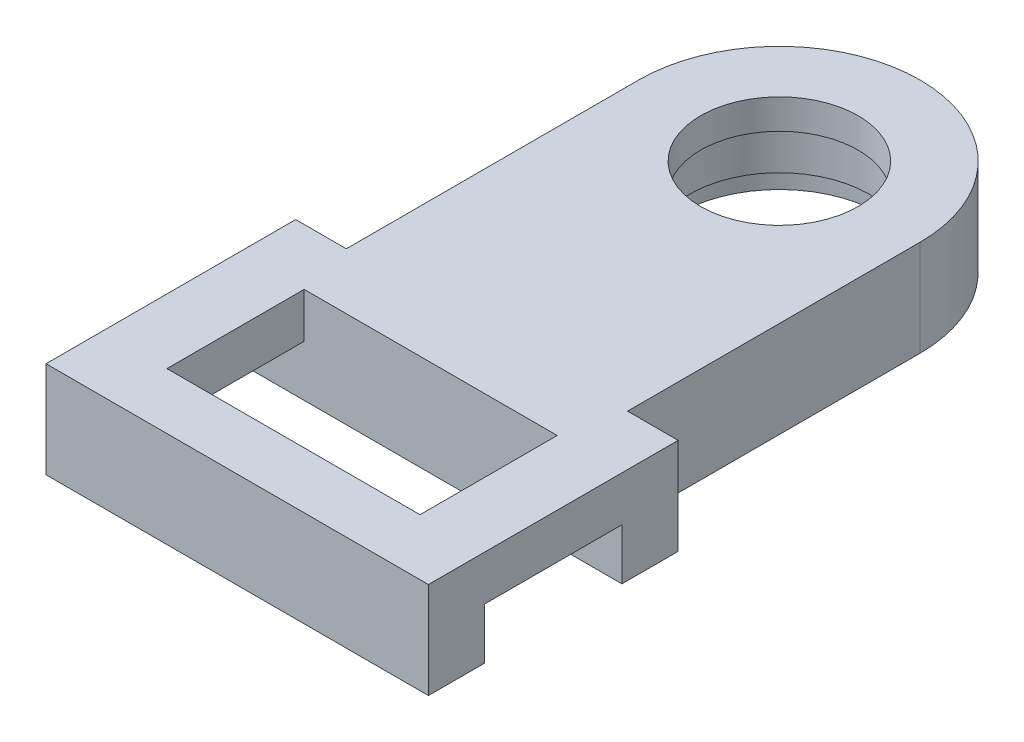
from build123d import *

# Parameters (mm, degrees)
SKETCH1_W           = 34
SKETCH1_H           = 22.2
SKETCH1_W_2         = 22.5
SKETCH1_H_2         = 12.2
BOSS_EXTRUDE1_DEPTH = 4
SKETCH2_R           = 8
BOSS_EXTRUDE3_DEPTH = 4
SKETCH3_R           = 9
SKETCH3_R_2         = 8
BOSS_EXTRUDE4_DEPTH = 2.55
SKETCH4_R           = 9
BOSS_EXTRUDE5_DEPTH = 4.55
SKETCH5_R           = 8
SKETCH5_R_2         = 7
BOSS_EXTRUDE8_DEPTH = 2.65


with BuildPart() as part:
    # Sketch1 → Boss-Extrude1 (new body)
    with BuildSketch(Plane(origin=(0, 0, 0), x_dir=(1, 0, 0), z_dir=(0, 1, 0))):
        Rectangle(SKETCH1_W, SKETCH1_H)
        Rectangle(SKETCH1_W_2, SKETCH1_H_2, mode=Mode.SUBTRACT)
    extrude(amount=BOSS_EXTRUDE1_DEPTH)

    # Sketch2 → Boss-Extrude3 (add, through all)
    with BuildSketch(Plane(origin=(0, 4, 0), x_dir=(1, 0, 0), z_dir=(0, 1, 0))):
        with BuildLine():
            Line((-12.5, 37.1), (-12.5, 11.1))
            Line((-12.5, 11.1), (12.5, 11.1))
            Line((12.5, 11.1), (12.5, 37.1))
            ThreePointArc((12.5, 37.1), (0, 49.6), (-12.5, 37.1))
        make_face()
        with Locations(Location((0, 37.1, 0), (0, 0, 270))):
            Circle(SKETCH2_R, mode=Mode.SUBTRACT)
    extrude(amount=-BOSS_EXTRUDE3_DEPTH)

    # Sketch3 → Boss-Extrude4 (add)
    with BuildSketch(Plane.XZ):
        with Locations(Location((0, -37.1, 0), (0, 0, 270))):
            Circle(SKETCH3_R)
        with Locations(Location((0, -37.1, 0), (0, 0, 90))):
            Circle(SKETCH3_R_2, mode=Mode.SUBTRACT)
    extrude(amount=BOSS_EXTRUDE4_DEPTH)

    # Sketch4 → Boss-Extrude5 (add)
    # profile 1 of 2: a face of its own
    with BuildSketch(Plane.XZ):
        with BuildLine():
            Line((12.5, -11.1), (17, -11.1))
            Line((17, -11.1), (17, -6.1))
            Line((17, -6.1), (11.25, -6.1))
            Line((11.25, -6.1), (-11.25, -6.1))
            Line((-11.25, -6.1), (-17, -6.1))
            Line((-17, -6.1), (-17, -11.1))
            Line((-17, -11.1), (-12.5, -11.1))
            Line((-12.5, -11.1), (-12.5, -37.1))
            ThreePointArc((-12.5, -37.1), (0, -49.6), (12.5, -37.1))
            Line((12.5, -37.1), (12.5, -11.1))
        make_face()
        with Locations(Location((0, -37.1, 0), (0, 0, 270))):
            Circle(SKETCH4_R, mode=Mode.SUBTRACT)
    # profile 2 of 2: a face of its own
    with BuildSketch(Plane.XZ):
        Polygon((11.25, 6.1), (17, 6.1), (17, 11.1), (-17, 11.1), (-17, 6.1), (-11.25, 6.1), align=None)
    extrude(amount=BOSS_EXTRUDE5_DEPTH)

    # Sketch5 → Boss-Extrude8 (add)
    with BuildSketch(Plane(origin=(0, 4, 0), x_dir=(1, 0, 0), z_dir=(0, 1, 0))):
        with Locations(Location((0, 37.1, 0), (0, 0, 270))):
            Circle(SKETCH5_R)
        with Locations(Location((0, 37.1, 0), (0, 0, 270))):
            Circle(SKETCH5_R_2, mode=Mode.SUBTRACT)
    extrude(amount=-BOSS_EXTRUDE8_DEPTH)


solid = part.part
